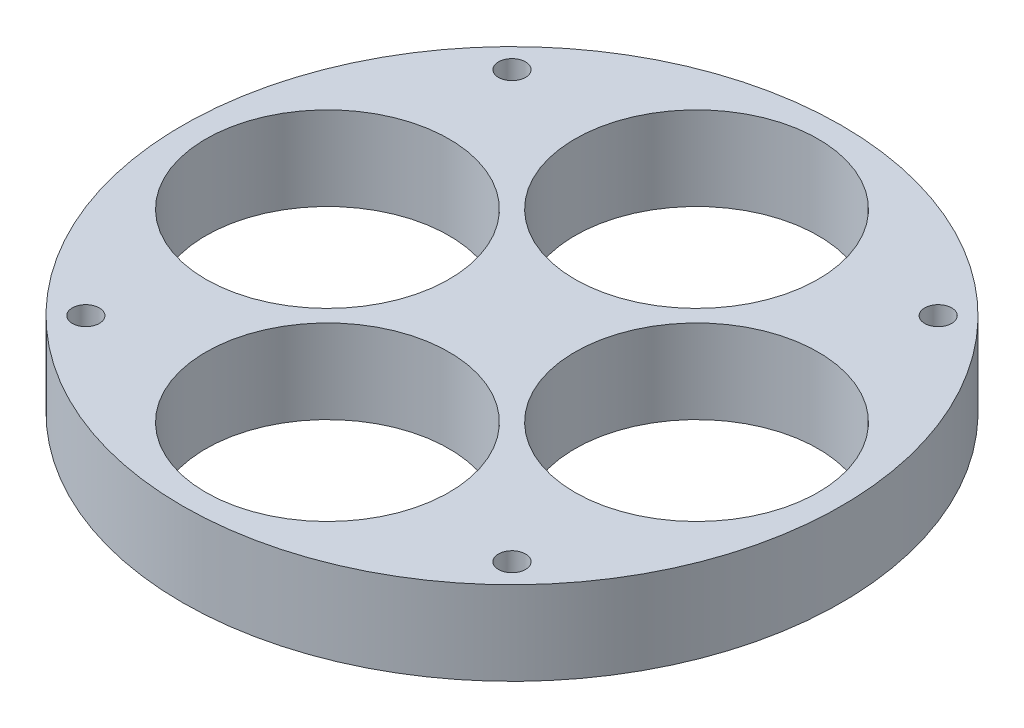
from build123d import *

# Parameters (mm, degrees)
SKETCH1_R           = 25
SKETCH1_R_2         = 1.025
SKETCH1_R_3         = 9.225
BOSS_EXTRUDE1_DEPTH = 6.35


with BuildPart() as part:
    # Sketch1 → Boss-Extrude1 (new body)
    with BuildSketch(Plane(origin=(0, 0, 0), x_dir=(1, 0, 0), z_dir=(0, 1, 0))):
        with Locations(Location((0, 0, 0), (0, 0, 270))):
            Circle(SKETCH1_R)
        with Locations(Location((16.164461018, 16.164461018, 0), (0, 0, 270))):
            Circle(SKETCH1_R_2, mode=Mode.SUBTRACT)
        with Locations(Location((16.164461018, -16.164461018, 0), (0, 0, 270))):
            Circle(SKETCH1_R_2, mode=Mode.SUBTRACT)
        with Locations(Location((-16.164461018, -16.164461018, 0), (0, 0, 270))):
            Circle(SKETCH1_R_2, mode=Mode.SUBTRACT)
        with Locations(Location((-16.164461018, 16.164461018, 0), (0, 0, 270))):
            Circle(SKETCH1_R_2, mode=Mode.SUBTRACT)
        with Locations(Location((14, 0, 0), (0, 0, 270))):
            Circle(SKETCH1_R_3, mode=Mode.SUBTRACT)
        with Locations(Location((0, -14, 0), (0, 0, 270))):
            Circle(SKETCH1_R_3, mode=Mode.SUBTRACT)
        with Locations(Location((-14, 0, 0), (0, 0, 270))):
            Circle(SKETCH1_R_3, mode=Mode.SUBTRACT)
        with Locations(Location((0, 14, 0), (0, 0, 270))):
            Circle(SKETCH1_R_3, mode=Mode.SUBTRACT)
    extrude(amount=BOSS_EXTRUDE1_DEPTH)


solid = part.part
